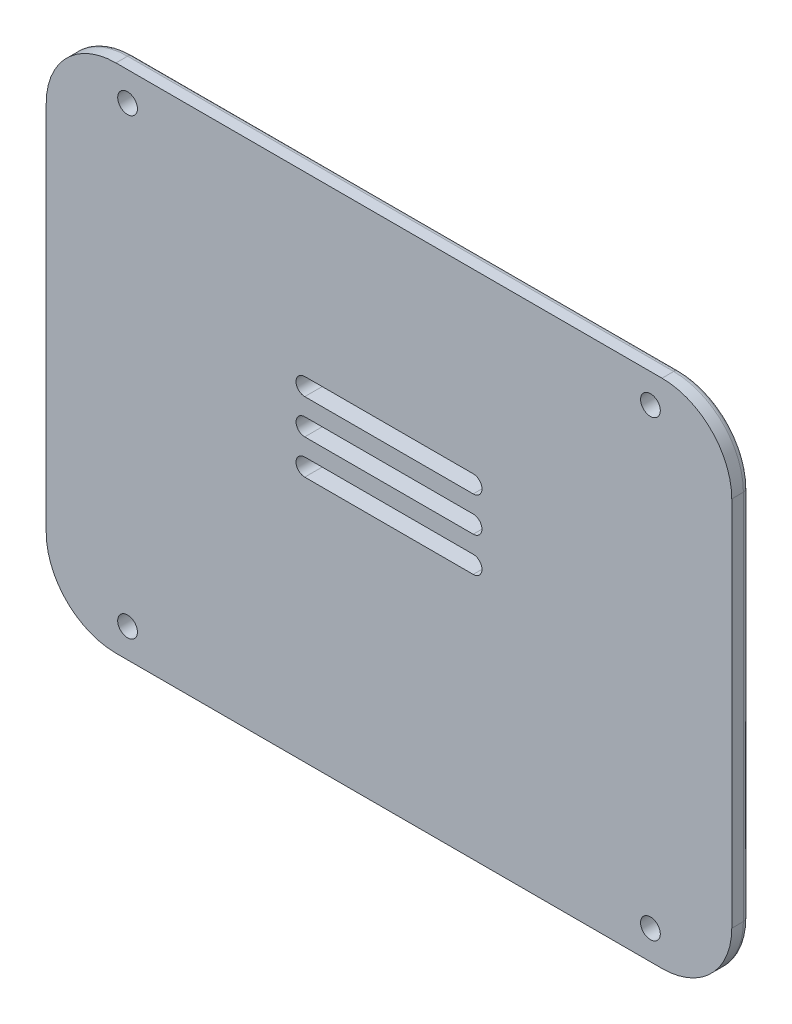
from build123d import *

# Parameters (mm, degrees)
BOSS_EXTRUDE1_DEPTH = 3
FILLET1_R           = 1
SKETCH2_R           = 1.7
CUT_EXTRUDE2_DEPTH  = 74.661387443
CUT_EXTRUDE3_DEPTH  = 74.661387443


with BuildPart() as part:
    # Sketch1 → Boss-Extrude1 (new body)
    with BuildSketch(Plane.XY):
        with BuildLine():
            Line((-47, -44), (47, -44))
            ThreePointArc((47, -44), (55.485281374, -40.485281374), (59, -32))
            Line((59, -32), (59, 32))
            ThreePointArc((59, 32), (55.485281374, 40.485281374), (47, 44))
            Line((47, 44), (-47, 44))
            ThreePointArc((-47, 44), (-55.485281374, 40.485281374), (-59, 32))
            Line((-59, 32), (-59, -32))
            ThreePointArc((-59, -32), (-55.485281374, -40.485281374), (-47, -44))
        make_face()
    extrude(amount=BOSS_EXTRUDE1_DEPTH)

    # Fillet1
    fillet1_edges = [part.edges().sort_by_distance(p)[0] for p in [
        (-59, 0, 0),
        (-55.485281374, 40.485281374, 0),
        (0, 44, 0),
        (55.485281374, 40.485281374, 0),
        (59, 0, 0),
        (55.485281374, -40.485281374, 0),
        (0, -44, 0),
        (-55.485281374, -40.485281374, 0),
    ]]
    fillet(fillet1_edges, radius=FILLET1_R)

    # Sketch2 → Cut-Extrude2 (cut, through all)
    with BuildSketch(Plane(origin=(0, 0, 0), x_dir=(-1, 0, 0), z_dir=(0, 0, -1))):
        with Locations((-45, 39)):
            Circle(SKETCH2_R)
        with Locations((-45, -39)):
            Circle(SKETCH2_R)
        with Locations((45, -39)):
            Circle(SKETCH2_R)
        with Locations((45, 39)):
            Circle(SKETCH2_R)
    extrude(amount=-CUT_EXTRUDE2_DEPTH, mode=Mode.SUBTRACT)

    # Sketch6 → Cut-Extrude3 (cut, through all)
    with BuildSketch(Plane(origin=(0, 0, 0), x_dir=(-1, 0, 0), z_dir=(0, 0, -1))):
        with BuildLine():
            Line((-14.5, 1.5), (14.5, 1.5))
            ThreePointArc((14.5, 1.5), (16, 0), (14.5, -1.5))
            Line((14.5, -1.5), (-14.5, -1.5))
            ThreePointArc((-14.5, -1.5), (-16, 0), (-14.5, 1.5))
        make_face()
        with BuildLine():
            Line((-14.5, 7.5), (14.5, 7.5))
            ThreePointArc((14.5, 7.5), (16, 6), (14.5, 4.5))
            Line((14.5, 4.5), (-14.5, 4.5))
            ThreePointArc((-14.5, 4.5), (-16, 6), (-14.5, 7.5))
        make_face()
        with BuildLine():
            Line((-14.5, 13.5), (14.5, 13.5))
            ThreePointArc((14.5, 13.5), (16, 12), (14.5, 10.5))
            Line((14.5, 10.5), (-14.5, 10.5))
            ThreePointArc((-14.5, 10.5), (-16, 12), (-14.5, 13.5))
        make_face()
    extrude(amount=-CUT_EXTRUDE3_DEPTH, mode=Mode.SUBTRACT)


solid = part.part
